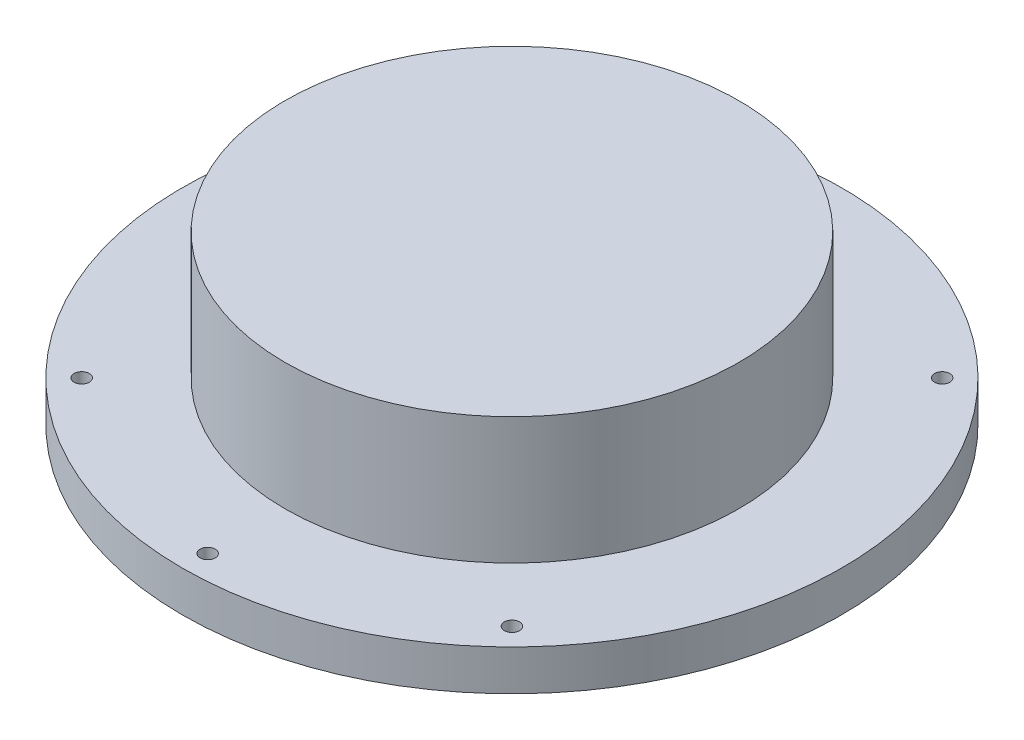
from build123d import *

# Parameters (mm, degrees)
SKETCH1_R           = 65
SKETCH1_R_2         = 1.5
BOSS_EXTRUDE1_DEPTH = 8
SKETCH3_R           = 44.745966538
BOSS_EXTRUDE2_DEPTH = 25


with BuildPart() as part:
    # Sketch1 → Boss-Extrude1 (new body)
    with BuildSketch(Plane(origin=(0, 0, 0), x_dir=(1, 0, 0), z_dir=(0, 1, 0))):
        with Locations(Location((0, 0, 0), (0, 0, 270))):
            Circle(SKETCH1_R)
        with Locations(Location((0, -60, 0), (0, 0, 270))):
            Circle(SKETCH1_R_2, mode=Mode.SUBTRACT)
        with Locations(Location((-42.426406871, -42.426406871, 0), (0, 0, 270))):
            Circle(SKETCH1_R_2, mode=Mode.SUBTRACT)
        with Locations(Location((-42.426406871, 42.426406871, 0), (0, 0, 270))):
            Circle(SKETCH1_R_2, mode=Mode.SUBTRACT)
        with Locations(Location((0, 60, 0), (0, 0, 270))):
            Circle(SKETCH1_R_2, mode=Mode.SUBTRACT)
        with Locations(Location((42.426406871, 42.426406871, 0), (0, 0, 270))):
            Circle(SKETCH1_R_2, mode=Mode.SUBTRACT)
        with Locations(Location((42.426406871, -42.426406871, 0), (0, 0, 270))):
            Circle(SKETCH1_R_2, mode=Mode.SUBTRACT)
    extrude(amount=BOSS_EXTRUDE1_DEPTH)

    # Sketch3 → Boss-Extrude2 (add)
    with BuildSketch(Plane(origin=(0, 8, 0), x_dir=(1, 0, 0), z_dir=(0, 1, 0))):
        with Locations(Location((0, 0, 0), (0, 0, 270))):
            Circle(SKETCH3_R)
    extrude(amount=BOSS_EXTRUDE2_DEPTH)


solid = part.part
